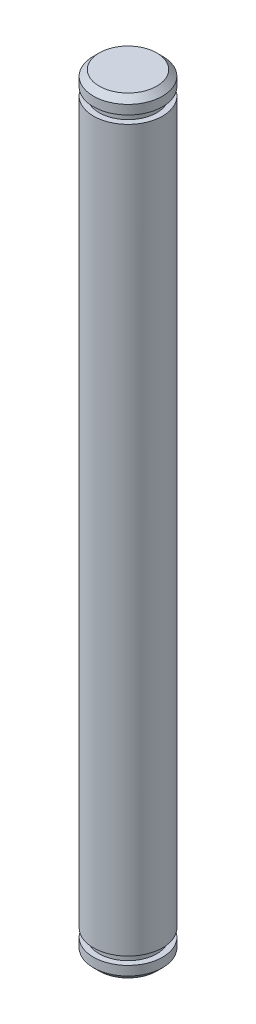
from build123d import *

# Parameters (mm, degrees)
SKETCH1_R          = 3
EXTRUDE_50_DEPTH   = 66.5
CUT_EXTRUDE1_START = -2
SKETCH2_R          = 3
SKETCH2_R_2        = 2.5
CUT_EXTRUDE1_DEPTH = 0.7
CUT_EXTRUDE2_START = -1.3
SKETCH3_R          = 3
SKETCH3_R_2        = 2.5
CUT_EXTRUDE2_DEPTH = 0.7
CHAMFER1_SIZE      = 0.5


with BuildPart() as part:
    # Sketch1 → Extrude 50 (new body)
    with BuildSketch(Plane(origin=(0, 0, 0), x_dir=(1, 0, 0), z_dir=(0, 1, 0))):
        with Locations(Location((0, 0, 0), (0, 0, 270))):
            Circle(SKETCH1_R)
    extrude(amount=EXTRUDE_50_DEPTH)

    # Sketch2 → Cut-Extrude1 (cut)
    with BuildSketch(Plane(origin=(0, 66.5, 0), x_dir=(1, 0, 0), z_dir=(0, 1, 0)).offset(CUT_EXTRUDE1_START)):
        with Locations(Location((0, 0, 0), (0, 0, 270))):
            Circle(SKETCH2_R)
        with Locations(Location((0, 0, 0), (0, 0, 270))):
            Circle(SKETCH2_R_2, mode=Mode.SUBTRACT)
    extrude(amount=CUT_EXTRUDE1_DEPTH, mode=Mode.SUBTRACT)

    # Sketch3 → Cut-Extrude2 (cut)
    with BuildSketch(Plane.XZ.offset(CUT_EXTRUDE2_START)):
        with Locations(Location((0, 0, 0), (0, 0, 270))):
            Circle(SKETCH3_R)
        with Locations(Location((0, 0, 0), (0, 0, 90))):
            Circle(SKETCH3_R_2, mode=Mode.SUBTRACT)
    extrude(amount=-CUT_EXTRUDE2_DEPTH, mode=Mode.SUBTRACT)

    # Chamfer1
    chamfer1_edges = [part.edges().sort_by_distance(p)[0] for p in [
        (0, 0, -3),
        (0, 66.5, -3),
    ]]
    chamfer(chamfer1_edges, length=CHAMFER1_SIZE)


solid = part.part
